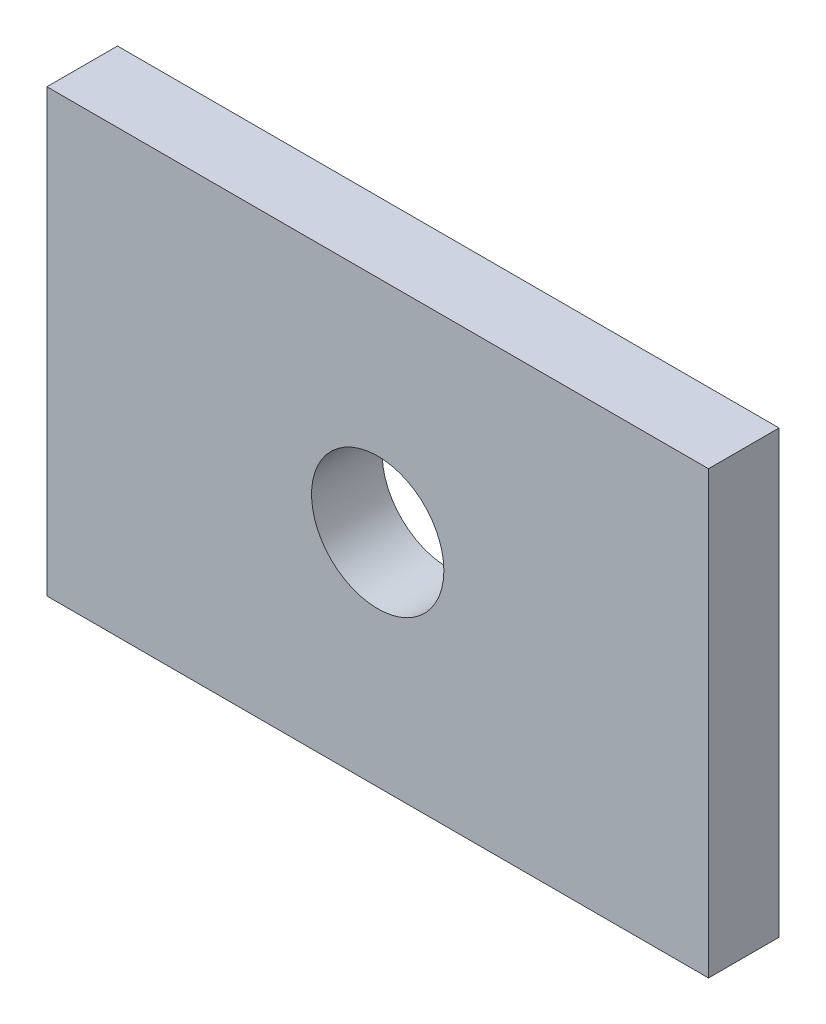
from build123d import *

# Parameters (mm, degrees)
SKETCH_1_W                = 150
SKETCH_1_H                = 100
EXTRUDE_1_DEPTH           = 16
HOLE_WIZARD_6_0_6_1_D     = 30
HOLE_WIZARD_6_0_6_1_DEPTH = 20
HOLE_WIZARD_6_0_6_1_TIP   = 9.012909285


with BuildPart() as part:
    # 草图1 → 凸台-拉伸1 (new body)
    with BuildSketch(Plane.XY):
        Rectangle(SKETCH_1_W, SKETCH_1_H)
    extrude(amount=EXTRUDE_1_DEPTH)

    # Ø6.0 (6) 直径孔1
    with Locations(Plane.XY.offset(16)):
        with Locations((0, 0)):
            Hole(HOLE_WIZARD_6_0_6_1_D / 2, depth=HOLE_WIZARD_6_0_6_1_DEPTH)
            with Locations((0, 0, -(HOLE_WIZARD_6_0_6_1_DEPTH + HOLE_WIZARD_6_0_6_1_TIP / 2))):  # 118° drill point
                Cone(0, HOLE_WIZARD_6_0_6_1_D / 2, HOLE_WIZARD_6_0_6_1_TIP, mode=Mode.SUBTRACT)


solid = part.part
